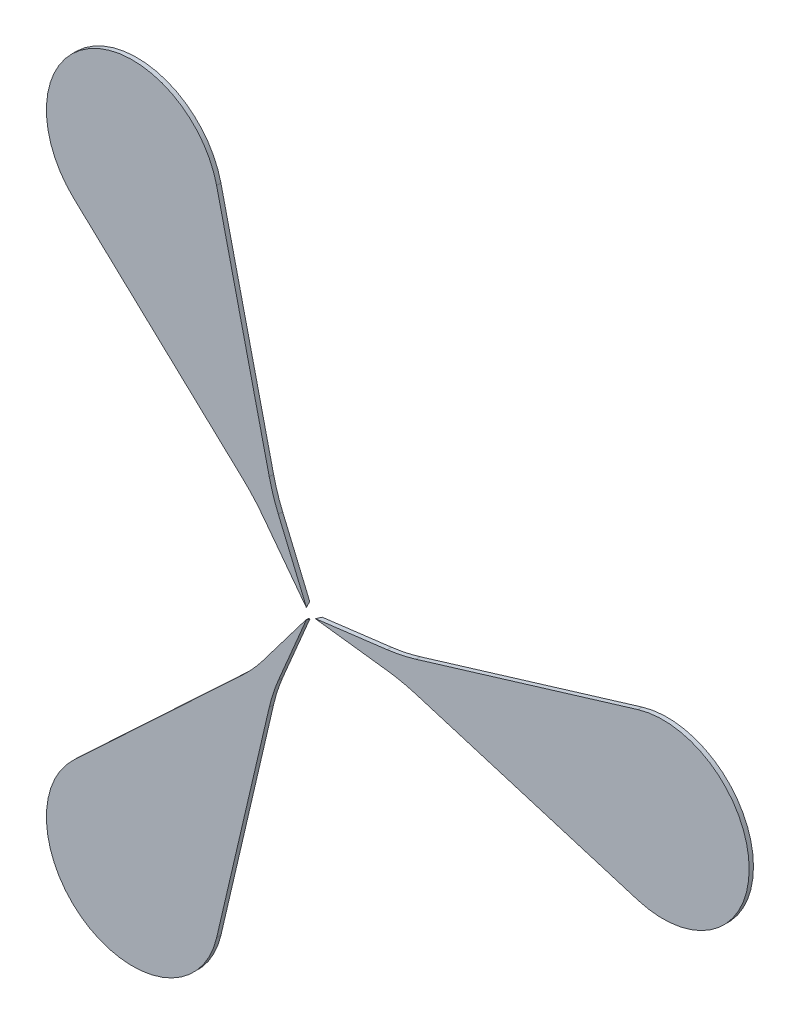
from build123d import *

# Parameters (mm, degrees)
EXTRUDE_2_DEPTH   = 0.25
EXTRUDE_2_2_DEPTH = 0.25
EXTRUDE_2_3_DEPTH = 0.25


with BuildPart() as part:
    # 草圖1 → 填料-伸長2 (new body)
    with BuildSketch(Plane.XY):
        with BuildLine():
            Line((0.357380647, 0.004961492), (4.50941379, 0.523267787))
            ThreePointArc((4.50941379, 0.523267787), (5.349803134, 0.664770922), (6.175092484, 0.877314741))
            Line((6.175092484, 0.877314741), (19.047808057, 4.784468472))
            ThreePointArc((19.047808057, 4.784468472), (25.5, 0), (19.047808057, -4.784468472))
            Line((19.047808057, -4.784468472), (6.175092484, -0.877314741))
            ThreePointArc((6.175092484, -0.877314741), (5.349803134, -0.664770922), (4.50941379, -0.523267787))
            Line((4.50941379, -0.523267787), (0.357380647, -0.004961492))
            ThreePointArc((0.357380647, -0.004961492), (0.353, 0), (0.357380647, 0.004961492))
        make_face()
    extrude(amount=EXTRUDE_2_DEPTH)


with BuildPart() as body_2:
    # 草圖1 → Extrude 2 2 (new body)
    with BuildSketch(Plane.XY):
        with BuildLine():
            Line((-0.182987102, -0.307019973), (-2.707870091, -3.643633005))
            ThreePointArc((-2.707870091, -3.643633005), (-3.250610073, -4.300679958), (-3.847323094, -4.909129591))
            Line((-3.847323094, -4.909129591), (-13.667375269, -14.103651428))
            ThreePointArc((-13.667375269, -14.103651428), (-12.75, -22.083647797), (-5.380432788, -18.8881199))
            Line((-5.380432788, -18.8881199), (-2.327769389, -5.786444332))
            ThreePointArc((-2.327769389, -5.786444332), (-2.09919306, -4.96545088), (-1.801543699, -4.166900792))
            Line((-1.801543699, -4.166900792), (-0.174393546, -0.311981465))
            ThreePointArc((-0.174393546, -0.311981465), (-0.1765, -0.305706968), (-0.182987102, -0.307019973))
        make_face()
    extrude(amount=EXTRUDE_2_2_DEPTH)


with BuildPart() as body_3:
    # 草圖1 → Extrude 2 3 (new body)
    with BuildSketch(Plane.XY):
        with BuildLine():
            Line((-0.174393546, 0.311981465), (-1.801543699, 4.166900792))
            ThreePointArc((-1.801543699, 4.166900792), (-2.09919306, 4.96545088), (-2.327769389, 5.786444332))
            Line((-2.327769389, 5.786444332), (-5.380432788, 18.8881199))
            ThreePointArc((-5.380432788, 18.8881199), (-12.75, 22.083647797), (-13.667375269, 14.103651428))
            Line((-13.667375269, 14.103651428), (-3.847323094, 4.909129591))
            ThreePointArc((-3.847323094, 4.909129591), (-3.250610073, 4.300679958), (-2.707870091, 3.643633005))
            Line((-2.707870091, 3.643633005), (-0.182987102, 0.307019973))
            ThreePointArc((-0.182987102, 0.307019973), (-0.1765, 0.305706968), (-0.174393546, 0.311981465))
        make_face()
    extrude(amount=EXTRUDE_2_3_DEPTH)


with BuildPart() as cut_revolve_1_tool:
    # 草圖2 → 除料-旋轉1 (revolve)
    with BuildSketch(Plane(origin=(0, 0, 0), x_dir=(1, 0, 0), z_dir=(0, 1, 0))):
        Polygon((0.353, -0.25), (0.497337567, 0), (0.353, 0), align=None)
    revolve(axis=Axis((0, 0, -0.385580205), (0, 0, 1)))


with BuildPart() as part_1:
    add(part.part)

    # 除料-旋轉1: cut by cut_revolve_1_tool
    add(cut_revolve_1_tool.part, mode=Mode.SUBTRACT)


with BuildPart() as body_2_1:
    add(body_2.part)

    # 除料-旋轉1: cut by cut_revolve_1_tool
    add(cut_revolve_1_tool.part, mode=Mode.SUBTRACT)


with BuildPart() as body_3_1:
    add(body_3.part)

    # 除料-旋轉1: cut by cut_revolve_1_tool
    add(cut_revolve_1_tool.part, mode=Mode.SUBTRACT)


solid = Compound([part_1.part, body_2_1.part, body_3_1.part])
